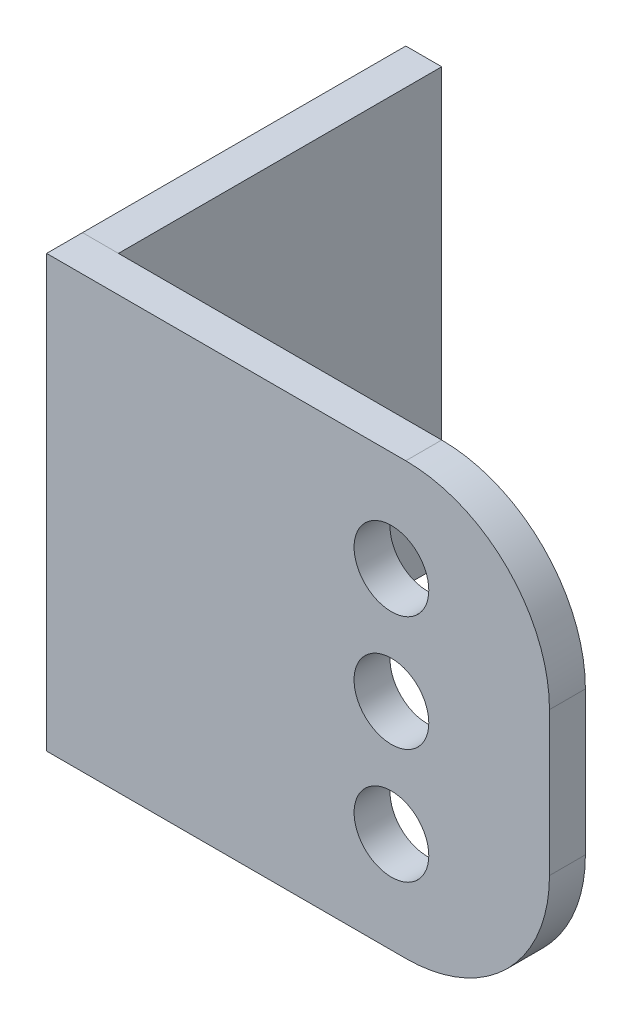
from build123d import *

# Parameters (mm, degrees)
SKETCH1_W               = 44.45
SKETCH1_H               = 38.1
BOSS_EXTRUDE1_DEPTH     = 3.175
CUT_EXTRUDE1_DEPTH      = 49.464271634
CUT_EXTRUDE1_DEPTH_BACK = 49.464271634
SKETCH2_R               = 3.302
SKETCH3_W               = 3.175
SKETCH3_H               = 38.1
BOSS_EXTRUDE2_DEPTH     = 28.575
FILLET1_R               = 12.7


with BuildPart() as part:
    # Sketch1 → Boss-Extrude1 (new body)
    with BuildSketch(Plane.XY):
        with Locations((22.225, 0)):
            Rectangle(SKETCH1_W, SKETCH1_H)
    extrude(amount=BOSS_EXTRUDE1_DEPTH)

    # Sketch2 → Cut-Extrude1 (cut, two sides: drawn at the far end of the back side and taken through both)
    with BuildSketch(Plane.XY.offset(3.175).offset(-CUT_EXTRUDE1_DEPTH_BACK)):
        with Locations((30.48, 10.16)):
            Circle(SKETCH2_R)
        with Locations((30.48, -10.16)):
            Circle(SKETCH2_R)
        with Locations((30.48, 0)):
            Circle(SKETCH2_R)
    extrude(amount=CUT_EXTRUDE1_DEPTH + CUT_EXTRUDE1_DEPTH_BACK, mode=Mode.SUBTRACT)

    # Fillet1
    fillet1_edges = [part.edges().sort_by_distance(p)[0] for p in [
        (44.45, 19.05, 1.5875),
        (44.45, -19.05, 1.5875),
    ]]
    fillet(fillet1_edges, radius=FILLET1_R)


with BuildPart() as body_2:
    # Sketch3 → Boss-Extrude2 (new body)
    with BuildSketch(Plane(origin=(0, 0, 0), x_dir=(-1, 0, 0), z_dir=(0, 0, -1))):
        with Locations((-1.5875, 0)):
            Rectangle(SKETCH3_W, SKETCH3_H)
    extrude(amount=BOSS_EXTRUDE2_DEPTH)


solid = Compound([part.part, body_2.part])
